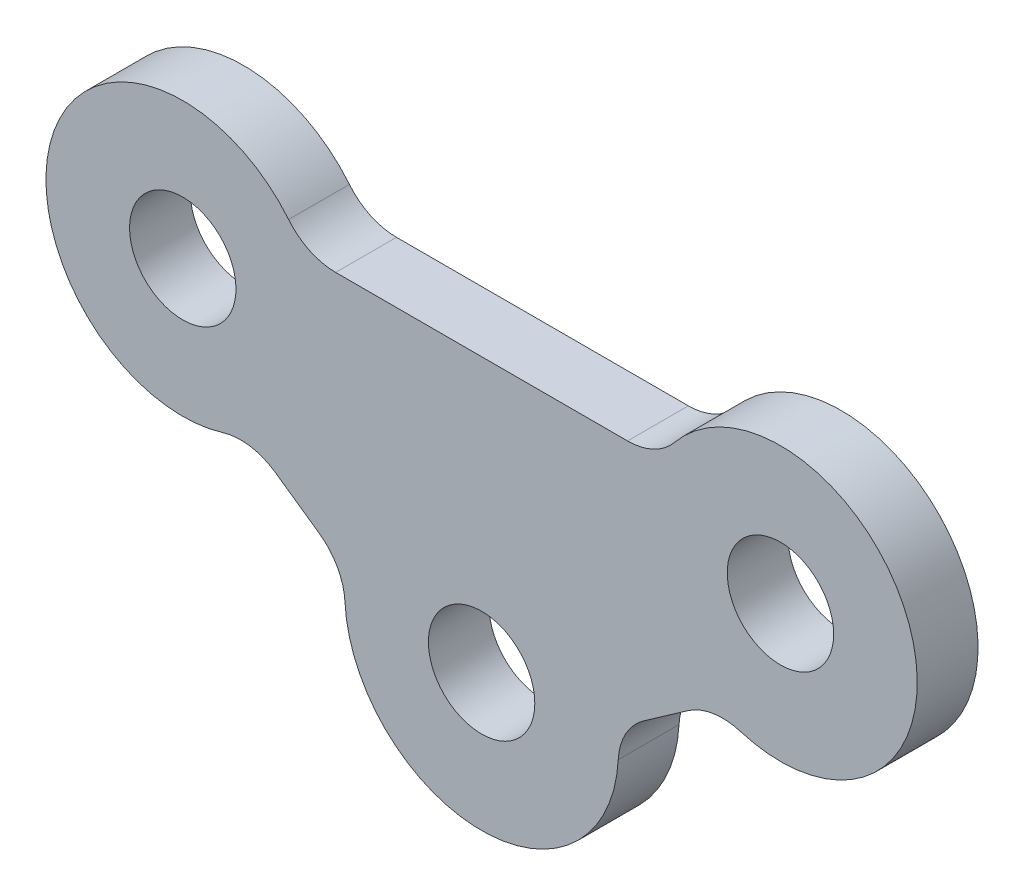
from build123d import *

# Parameters (mm, degrees)
SKETCH1_R           = 1.75
BOSS_EXTRUDE1_DEPTH = 2


with BuildPart() as part:
    # Sketch1 → Boss-Extrude1 (new body)
    with BuildSketch(Plane.XY):
        with BuildLine():
            Line((6.78007207, 2.305908396), (5.344058207, 1.300400663))
            ThreePointArc((5.344058207, 1.300400663), (4.741801382, 0.631408553), (4.493915363, -0.233933141))
            ThreePointArc((4.493915363, -0.233933141), (0, -4.5), (-4.493915363, -0.233933141))
            ThreePointArc((-4.493915363, -0.233933141), (-4.741801382, 0.631408553), (-5.344058207, 1.300400663))
            Line((-5.344058207, 1.300400663), (-6.78007207, 2.305908396))
            ThreePointArc((-6.78007207, 2.305908396), (-7.614702985, 2.643035912), (-8.512640201, 2.580008285))
            ThreePointArc((-8.512640201, 2.580008285), (-14.136868529, 8.186516868), (-6.347604272, 9.733205303))
            ThreePointArc((-6.347604272, 9.733205303), (-5.656224906, 9.192572354), (-4.799950824, 9))
            Line((-4.799950824, 9), (4.799950824, 9))
            ThreePointArc((4.799950824, 9), (5.656224906, 9.192572354), (6.347604272, 9.733205303))
            ThreePointArc((6.347604272, 9.733205303), (14.136868529, 8.186516868), (8.512640201, 2.580008285))
            ThreePointArc((8.512640201, 2.580008285), (7.614702985, 2.643035912), (6.78007207, 2.305908396))
        make_face()
        Circle(SKETCH1_R, mode=Mode.SUBTRACT)
        with Locations((9.829824531, 6.882917236)):
            Circle(SKETCH1_R, mode=Mode.SUBTRACT)
        with Locations(Location((-9.829824531, 6.882917236, 0), (0, 0, 180))):
            Circle(SKETCH1_R, mode=Mode.SUBTRACT)
    extrude(amount=BOSS_EXTRUDE1_DEPTH)


solid = part.part
